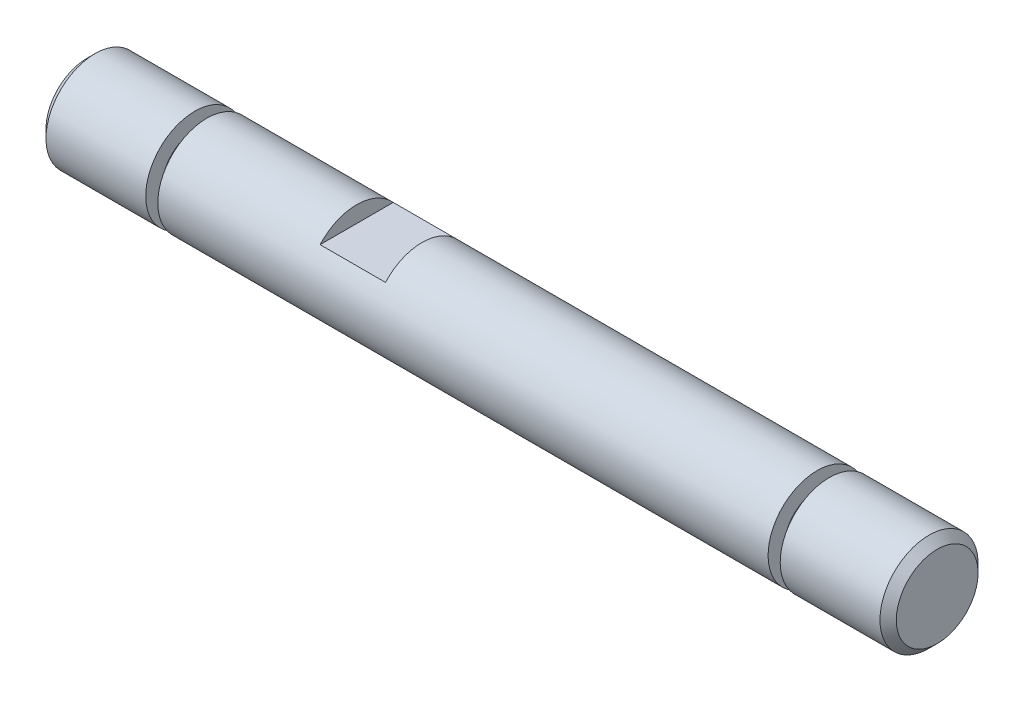
from build123d import *

# Parameters (mm, degrees)
ESQUISSE1_W                  = 52
ESQUISSE1_H                  = 3
CHANFREIN1_SIZE              = 0.5
ENL_V_MAT_EXTRU_1_DEPTH      = 27.343879745
ENL_V_MAT_EXTRU_1_DEPTH_BACK = 27.343879745
ESQUISSE2_W                  = 4
ESQUISSE2_H                  = 2
ESQUISSE3_W                  = 0.74
ESQUISSE3_H                  = 1


with BuildPart() as part:
    # Esquisse1 → Révolution1 (revolve)
    with BuildSketch(Plane.XY, mode=Mode.PRIVATE) as r_volution1_sk:
        with Locations((0, 1.5)):
            Rectangle(ESQUISSE1_W, ESQUISSE1_H)
    revolve(r_volution1_sk.sketch.rotate(Axis((0, 0, 0), (1, 0, 0)), 90), axis=Axis((0, 0, 0), (1, 0, 0)))

    # Chanfrein1
    chanfrein1_edges = [part.edges().sort_by_distance(p)[0] for p in [
        (26, 0, -3),
        (-26, 0, -3),
    ]]
    chamfer(chanfrein1_edges, length=CHANFREIN1_SIZE)

    # Esquisse2 → Enlèv. mat.-Extru.1 (cut, two sides: drawn at the far end of the back side and taken through both)
    with BuildSketch(Plane.XY.offset(-ENL_V_MAT_EXTRU_1_DEPTH_BACK)):
        with Locations((-7.5, 3)):
            Rectangle(ESQUISSE2_W, ESQUISSE2_H)
    extrude(amount=ENL_V_MAT_EXTRU_1_DEPTH + ENL_V_MAT_EXTRU_1_DEPTH_BACK, mode=Mode.SUBTRACT)

    # Esquisse3 → Enlèvement de matière-Révolution1 (revolve, cut)
    with BuildSketch(Plane.XY):
        with Locations((-19.03, 2.5)):
            Rectangle(ESQUISSE3_W, ESQUISSE3_H)
        with Locations((19.03, 2.5)):
            Rectangle(ESQUISSE3_W, ESQUISSE3_H)
    revolve(axis=Axis((0, 0, 0), (-1, 0, 0)), mode=Mode.SUBTRACT)


solid = part.part
